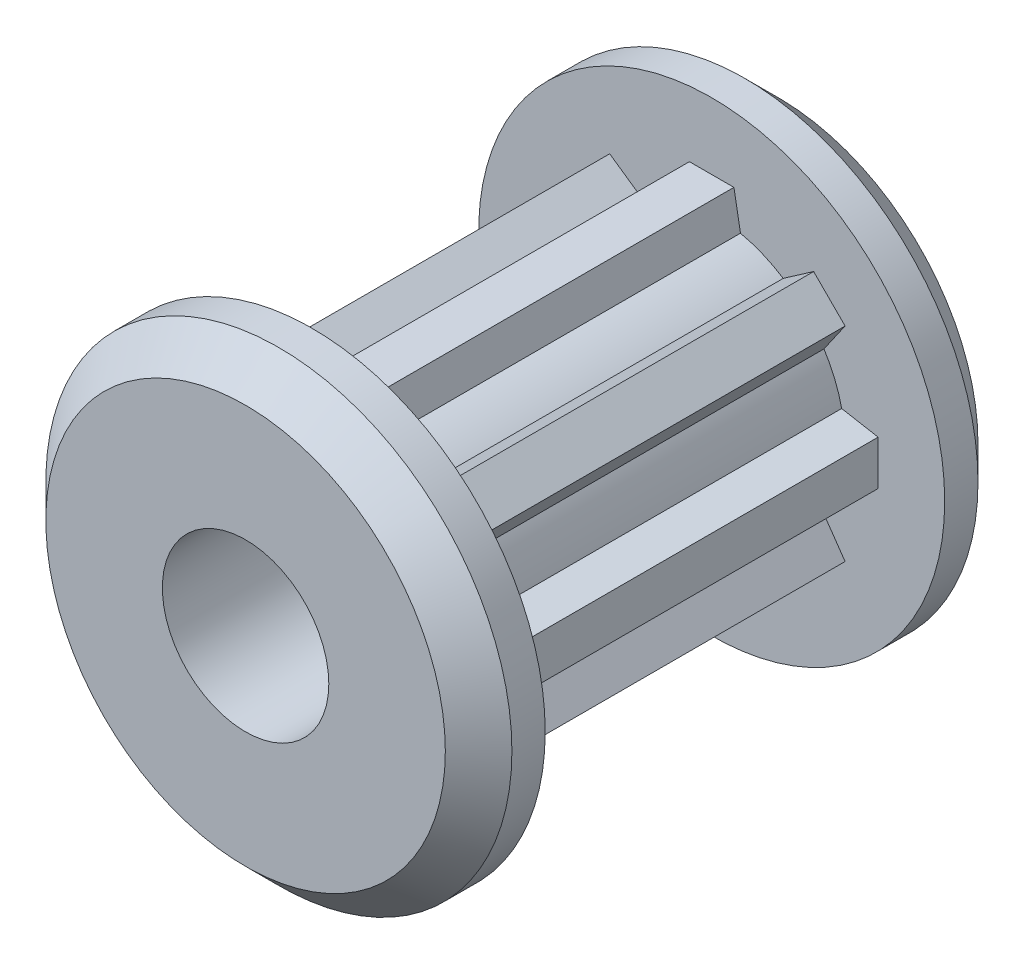
from build123d import *

# Parameters (mm, degrees)
SKETCH1_R               = 4
BOSS_EXTRUDE1_DEPTH     = 6
SKETCH2_R               = 7
BOSS_EXTRUDE2_DEPTH     = 2
LPATTERN1_COUNT         = 2
LPATTERN1_PITCH         = 14
CUT_EXTRUDE1_DEPTH      = 13.727922061
CUT_EXTRUDE1_DEPTH_BACK = 13.727922061
SKETCH3_R               = 2.5
CHAMFER1_SIZE           = 1
BOSS_EXTRUDE3_DEPTH     = 6
CIRPATTERN1_COUNT       = 8


with BuildPart() as part:
    # Sketch1 → Boss-Extrude1 (new, symmetric)
    with BuildSketch(Plane.XY):
        Circle(SKETCH1_R)
    extrude(amount=BOSS_EXTRUDE1_DEPTH, both=True)

    # Sketch2 → Boss-Extrude2 (add)
    with BuildSketch(Plane.XY.offset(6)):
        Circle(SKETCH2_R)
    boss_extrude2 = extrude(amount=BOSS_EXTRUDE2_DEPTH)

    # LPattern1: Boss-Extrude2 ×2
    with Locations(*[(0, 0, -i * LPATTERN1_PITCH) for i in range(1, LPATTERN1_COUNT)]):
        add(boss_extrude2)

    # Sketch3 → Cut-Extrude1 (cut, two sides: drawn at the far end of the back side and taken through both)
    with BuildSketch(Plane.XY.offset(-CUT_EXTRUDE1_DEPTH_BACK)):
        Circle(SKETCH3_R)
    extrude(amount=CUT_EXTRUDE1_DEPTH + CUT_EXTRUDE1_DEPTH_BACK, mode=Mode.SUBTRACT)

    # Chamfer1
    chamfer1_edges = [part.edges().sort_by_distance(p)[0] for p in [
        (-7, 0, 8),
        (-7, 0, -8),
    ]]
    chamfer(chamfer1_edges, length=CHAMFER1_SIZE)

    # Sketch6 → Boss-Extrude3 (add, symmetric)
    with BuildSketch(Plane.XY):
        Polygon((1.1, 2.6), (0.668195185, 5), (-0.668195185, 5), (-1.1, 2.6), align=None)
    boss_extrude3 = extrude(amount=BOSS_EXTRUDE3_DEPTH, both=True)

    # CirPattern1: Boss-Extrude3 ×8 about axis
    cirpattern1_axis = Axis((0, 0, 0), (0, 0, 1))
    for i in range(1, CIRPATTERN1_COUNT):
        add(boss_extrude3.rotate(cirpattern1_axis, i * 360 / CIRPATTERN1_COUNT))


solid = part.part
